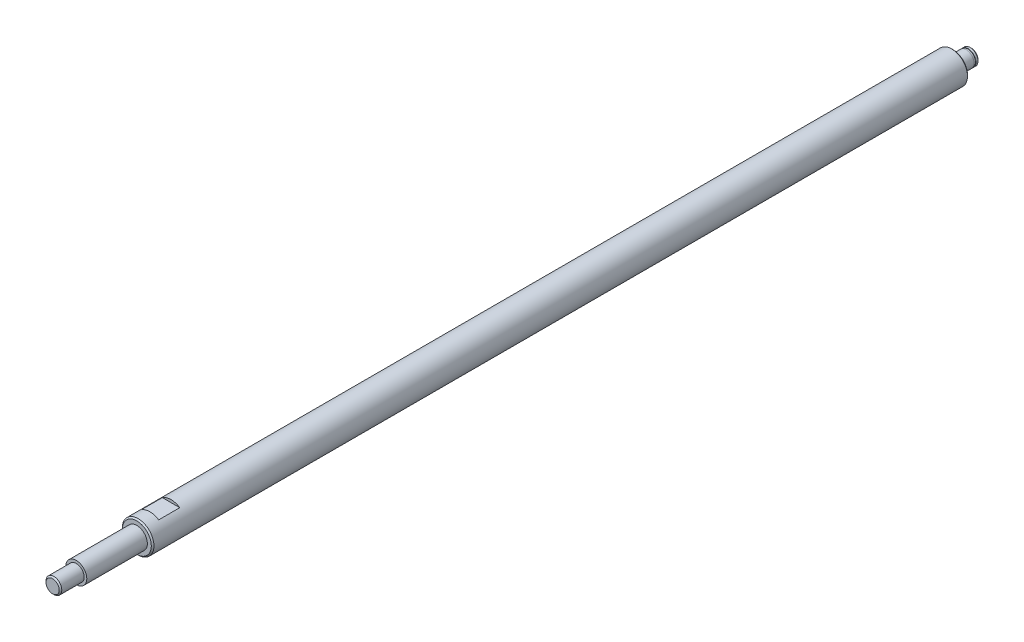
from build123d import *

# Parameters (mm, degrees)
SKETCH_1_R          = 6
EXTRUDE_1_DEPTH     = 155
SKETCH_2_R          = 3
EXTRUDE_2_DEPTH     = 7
CUT_EXTRUDE_START   = 5
SKETCH_3_R          = 3
SKETCH_3_R_2        = 2.85
CUT_EXTRUDE_1_DEPTH = 0.7
SKETCH_4_R          = 4
EXTRUDE_3_DEPTH     = 23
EXTRUDE_START       = 9
SKETCH_5_R          = 3
EXTRUDE_4_DEPTH     = 9
CHAMFER_1_SIZE      = 0.5
SKETCH_6_W          = 9.301869948
SKETCH_6_H          = 8
CUT_EXTRUDE_2_DEPTH = 1


with BuildPart() as part:
    # 草图1 → 凸台-拉伸1 (new, symmetric)
    with BuildSketch(Plane.XY):
        Circle(SKETCH_1_R)
    extrude(amount=EXTRUDE_1_DEPTH, both=True)

    # 草图2 → 凸台-拉伸2 (add)
    with BuildSketch(Plane(origin=(0, 0, -155), x_dir=(-1, 0, 0), z_dir=(0, 0, -1))):
        with Locations(Location((0, 0, 0), (0, 0, 180))):
            Circle(SKETCH_2_R)
    extrude(amount=EXTRUDE_2_DEPTH)

    # 草图3 → 切除-拉伸1 (cut)
    with BuildSketch(Plane(origin=(0, 0, -155), x_dir=(-1, 0, 0), z_dir=(0, 0, -1)).offset(CUT_EXTRUDE_START)):
        with Locations(Location((0, 0, 0), (0, 0, 180))):
            Circle(SKETCH_3_R)
        Circle(SKETCH_3_R_2, mode=Mode.SUBTRACT)
    extrude(amount=CUT_EXTRUDE_1_DEPTH, mode=Mode.SUBTRACT)

    # 草图4 → 凸台-拉伸3 (add)
    with BuildSketch(Plane.XY.offset(155)):
        Circle(SKETCH_4_R)
    extrude(amount=EXTRUDE_3_DEPTH)

    # 草图5 → 凸台-拉伸4 (add)
    with BuildSketch(Plane.XY.offset(178).offset(EXTRUDE_START)):
        Circle(SKETCH_5_R)
    extrude(amount=-EXTRUDE_4_DEPTH)

    # 倒角1
    chamfer_1_edges = [part.edges().sort_by_distance(p)[0] for p in [
        (-6, 0, -155),
        (-3, 0, 187),
        (-6, 0, 155),
        (-3, 0, -162),
    ]]
    chamfer(chamfer_1_edges, length=CHAMFER_1_SIZE)

    # 草图6 → 切除-拉伸2 (cut)
    with BuildSketch(Plane(origin=(0, 6, 0), x_dir=(1, 0, 0), z_dir=(0, 1, 0))):
        with Locations((0, -146)):
            Rectangle(SKETCH_6_W, SKETCH_6_H)
    cut_extrude_2 = extrude(amount=-CUT_EXTRUDE_2_DEPTH, mode=Mode.SUBTRACT)

    # 镜向1: 切除-拉伸2 across plane
    add(cut_extrude_2.mirror(Plane.ZX), mode=Mode.SUBTRACT)


solid = part.part
